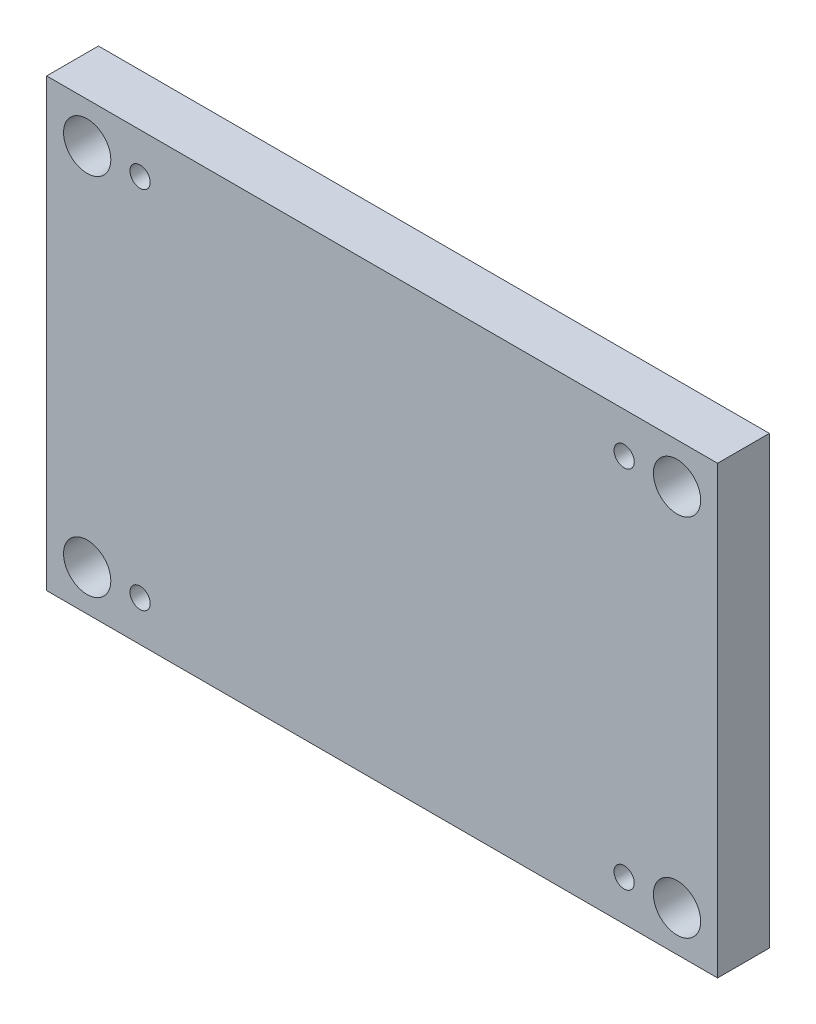
from build123d import *

# Parameters (mm, degrees)
SZKIC1_W                    = 596
SZKIC1_H                    = 396
DODANIE_WYCI_GNI_CIE1_DEPTH = 46
SZKIC2_R                    = 21
WYTNIJ_WYCI_GNI_CIE1_DEPTH  = 46
SZKIC3_R                    = 21
WYTNIJ_WYCI_GNI_CIE2_DEPTH  = 46
SZKIC4_R                    = 21
WYTNIJ_WYCI_GNI_CIE3_DEPTH  = 46
SZKIC5_R                    = 21
WYTNIJ_WYCI_GNI_CIE4_DEPTH  = 46
SZKIC6_W                    = 46
SZKIC6_H                    = 9
SZKIC7_W                    = 46
SZKIC7_H                    = 9
SZKIC8_W                    = 46
SZKIC8_H                    = 9
SZKIC9_W                    = 46
SZKIC9_H                    = 9


with BuildPart() as part:
    # Szkic1 → Dodanie-wyciągnięcie1 (new body)
    with BuildSketch(Plane.XY):
        Rectangle(SZKIC1_W, SZKIC1_H)
    extrude(amount=DODANIE_WYCI_GNI_CIE1_DEPTH)

    # Szkic2 → Wytnij-wyciągnięcie1 (cut)
    with BuildSketch(Plane.XY.offset(46)):
        with Locations((262, 162)):
            Circle(SZKIC2_R)
    extrude(amount=-WYTNIJ_WYCI_GNI_CIE1_DEPTH, mode=Mode.SUBTRACT)

    # Szkic3 → Wytnij-wyciągnięcie2 (cut)
    with BuildSketch(Plane.XY.offset(46)):
        with Locations((262, -162)):
            Circle(SZKIC3_R)
    extrude(amount=-WYTNIJ_WYCI_GNI_CIE2_DEPTH, mode=Mode.SUBTRACT)

    # Szkic4 → Wytnij-wyciągnięcie3 (cut)
    with BuildSketch(Plane.XY.offset(46)):
        with Locations((-262, -162)):
            Circle(SZKIC4_R)
    extrude(amount=-WYTNIJ_WYCI_GNI_CIE3_DEPTH, mode=Mode.SUBTRACT)

    # Szkic5 → Wytnij-wyciągnięcie4 (cut)
    with BuildSketch(Plane.XY.offset(46)):
        with Locations((-262, 162)):
            Circle(SZKIC5_R)
    extrude(amount=-WYTNIJ_WYCI_GNI_CIE4_DEPTH, mode=Mode.SUBTRACT)

    # Szkic6 → Wycięcie-obrót1 (revolve, cut)
    with BuildSketch(Plane(origin=(215, 0, 0), x_dir=(0, 0, -1), z_dir=(1, 0, 0))):
        with Locations((-23, 166.5)):
            Rectangle(SZKIC6_W, SZKIC6_H)
    revolve(axis=Axis((215, 162, 0), (0, 0, 1)), mode=Mode.SUBTRACT)

    # Szkic7 → Wycięcie-obrót2 (revolve, cut)
    with BuildSketch(Plane(origin=(215, 0, 0), x_dir=(0, 0, -1), z_dir=(1, 0, 0))):
        with Locations((-23, -166.5)):
            Rectangle(SZKIC7_W, SZKIC7_H)
    revolve(axis=Axis((215, -162, 46), (0, 0, -1)), mode=Mode.SUBTRACT)

    # Szkic8 → Wycięcie-obrót3 (revolve, cut)
    with BuildSketch(Plane(origin=(-215, 0, 0), x_dir=(0, 0, -1), z_dir=(1, 0, 0))):
        with Locations((-23, 166.5)):
            Rectangle(SZKIC8_W, SZKIC8_H)
    revolve(axis=Axis((-215, 162, 0), (0, 0, 1)), mode=Mode.SUBTRACT)

    # Szkic9 → Wycięcie-obrót4 (revolve, cut)
    with BuildSketch(Plane(origin=(-215, 0, 0), x_dir=(0, 0, -1), z_dir=(1, 0, 0))):
        with Locations((-23, -166.5)):
            Rectangle(SZKIC9_W, SZKIC9_H)
    revolve(axis=Axis((-215, -162, 46), (0, 0, -1)), mode=Mode.SUBTRACT)


solid = part.part
